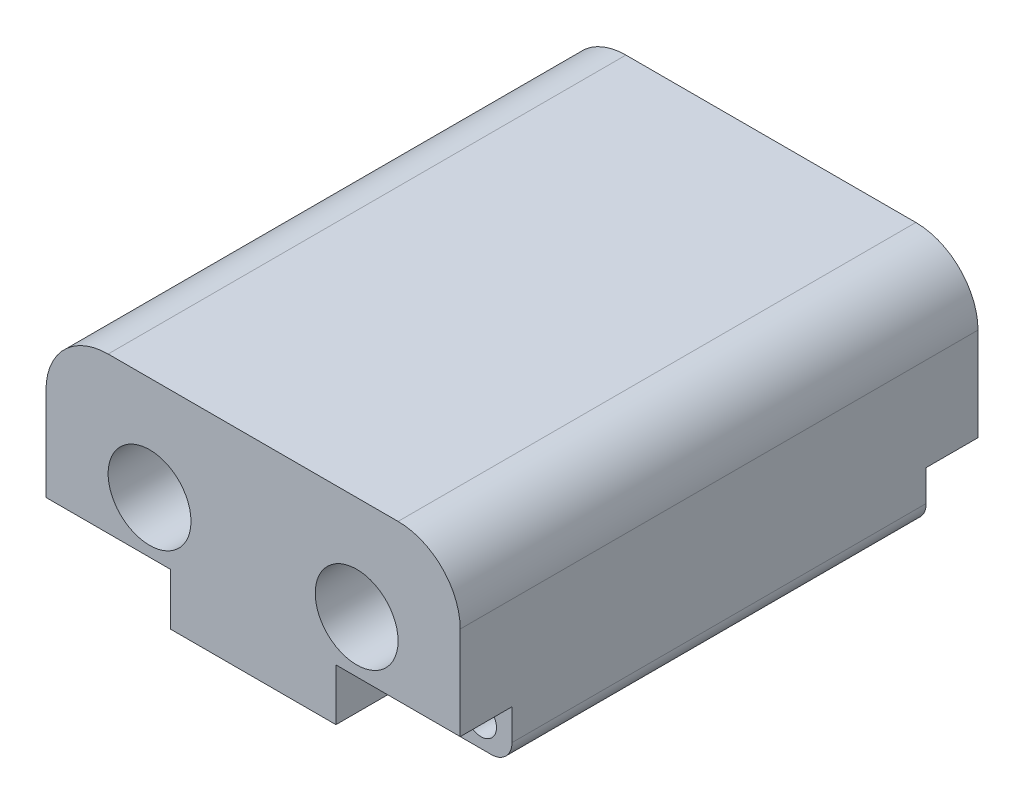
from build123d import *

# Parameters (mm, degrees)
ESQUISSE1_W             = 40
ESQUISSE1_H             = 20
ESQUISSE1_R             = 4
BOSS_EXTRU_1_DEPTH      = 50
ESQUISSE2_W             = 12
ESQUISSE2_H             = 5
ENL_V_MAT_EXTRU_1_DEPTH = 5
ESQUISSE3_R             = 1.5
ENL_V_MAT_EXTRU_2_DEPTH = 8
CONG_2_R                = 6
CONG_3_R                = 2


with BuildPart() as part:
    # Esquisse1 → Boss.-Extru.1 (new body)
    with BuildSketch(Plane.XY):
        Rectangle(ESQUISSE1_W, ESQUISSE1_H)
        with Locations((-10, 0)):
            Circle(ESQUISSE1_R, mode=Mode.SUBTRACT)
        with Locations((10, 0)):
            Circle(ESQUISSE1_R, mode=Mode.SUBTRACT)
    extrude(amount=BOSS_EXTRU_1_DEPTH)

    # Esquisse2 → Enlèv. mat.-Extru.1 (cut)
    with BuildSketch(Plane.XY.offset(50)):
        with Locations((-14, -7.5)):
            Rectangle(ESQUISSE2_W, ESQUISSE2_H)
        with Locations((14, -7.5)):
            Rectangle(ESQUISSE2_W, ESQUISSE2_H)
    enl_v_mat_extru_1 = extrude(amount=-ENL_V_MAT_EXTRU_1_DEPTH, mode=Mode.SUBTRACT)

    # Esquisse3 → Enlèv. mat.-Extru.2 (cut)
    with BuildSketch(Plane.XY.offset(45)):
        with Locations((-17, -7.5)):
            Circle(ESQUISSE3_R)
        with Locations(Location((-11, -7.5, 0), (0, 0, 180))):
            Circle(ESQUISSE3_R)
        with Locations(Location((17, -7.5, 0), (0, 0, 180))):
            Circle(ESQUISSE3_R)
        with Locations((11, -7.5)):
            Circle(ESQUISSE3_R)
    enl_v_mat_extru_2 = extrude(amount=-ENL_V_MAT_EXTRU_2_DEPTH, mode=Mode.SUBTRACT)

    # Symétrie1: Enlèv. mat.-Extru.1, Enlèv. mat.-Extru.2 across plane
    add(enl_v_mat_extru_1.mirror(Plane.XY.offset(25)), mode=Mode.SUBTRACT)
    add(enl_v_mat_extru_2.mirror(Plane.XY.offset(25)), mode=Mode.SUBTRACT)

    # Congé2
    cong_2_edges = [part.edges().sort_by_distance(p)[0] for p in [
        (-20, 10, 25),
        (20, 10, 25),
    ]]
    fillet(cong_2_edges, radius=CONG_2_R)

    # Congé3
    cong_3_edges = [part.edges().sort_by_distance(p)[0] for p in [
        (20, -10, 25),
        (-20, -10, 25),
    ]]
    fillet(cong_3_edges, radius=CONG_3_R)


solid = part.part
